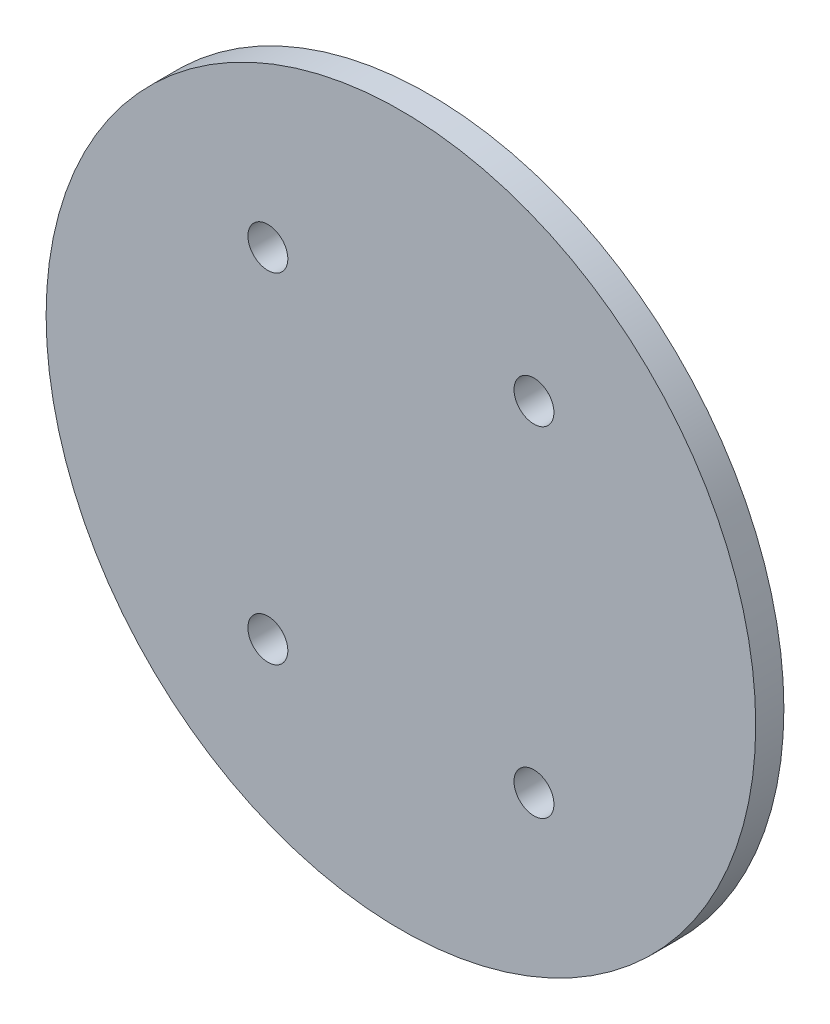
from build123d import *

# Parameters (mm, degrees)
SKETCH1_R            = 40
BOSS_EXTRUDE1_DEPTH  = 1.5875
M4_CLEARANCE_HOLE1_D = 4.5


with BuildPart() as part:
    # Sketch1 → Boss-Extrude1 (new, symmetric)
    with BuildSketch(Plane.XY):
        Circle(SKETCH1_R)
    extrude(amount=BOSS_EXTRUDE1_DEPTH, both=True)

    # M4 Clearance Hole1 (through all)
    with Locations(Plane(origin=(0, 0, -1.5875), x_dir=(-1, 0, 0), z_dir=(0, 0, -1))):
        with Locations((15, 19.125), (-15, 19.125), (-15, -19.125), (15, -19.125)):
            Hole(M4_CLEARANCE_HOLE1_D / 2)


solid = part.part
